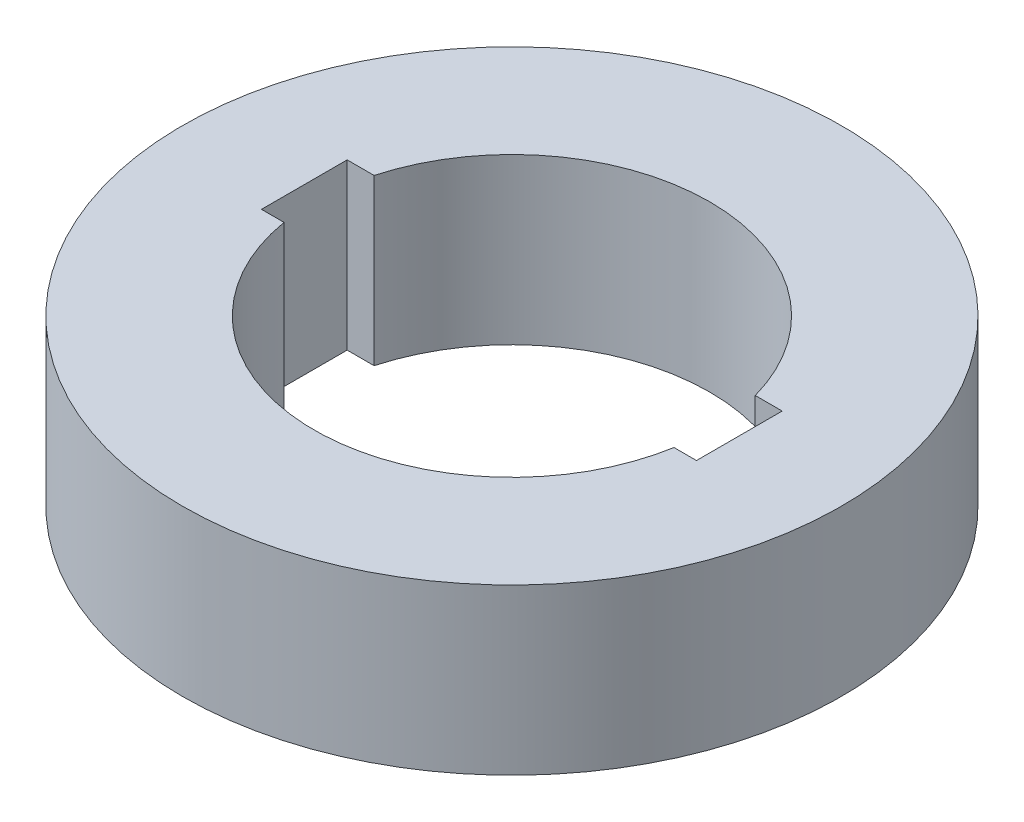
from build123d import *

# Parameters (mm, degrees)
SKETCH2_R           = 50
SKETCH2_R_2         = 30
BOSS_EXTRUDE1_DEPTH = 25
SKETCH3_W           = 66
SKETCH3_H           = 13
CUT_EXTRUDE1_DEPTH  = 25


with BuildPart() as part:
    # Sketch2 → Boss-Extrude1 (new body)
    with BuildSketch(Plane(origin=(0, 0, 0), x_dir=(1, 0, 0), z_dir=(0, 1, 0))):
        with Locations(Location((0, 0, 0), (0, 0, 270))):
            Circle(SKETCH2_R)
        with Locations(Location((0, 0, 0), (0, 0, 270))):
            Circle(SKETCH2_R_2, mode=Mode.SUBTRACT)
    extrude(amount=BOSS_EXTRUDE1_DEPTH)

    # Sketch3 → Cut-Extrude1 (cut)
    with BuildSketch(Plane(origin=(0, 25, 0), x_dir=(1, 0, 0), z_dir=(0, 1, 0))):
        with Locations((0, 1.5)):
            Rectangle(SKETCH3_W, SKETCH3_H)
    extrude(amount=-CUT_EXTRUDE1_DEPTH, mode=Mode.SUBTRACT)


solid = part.part
